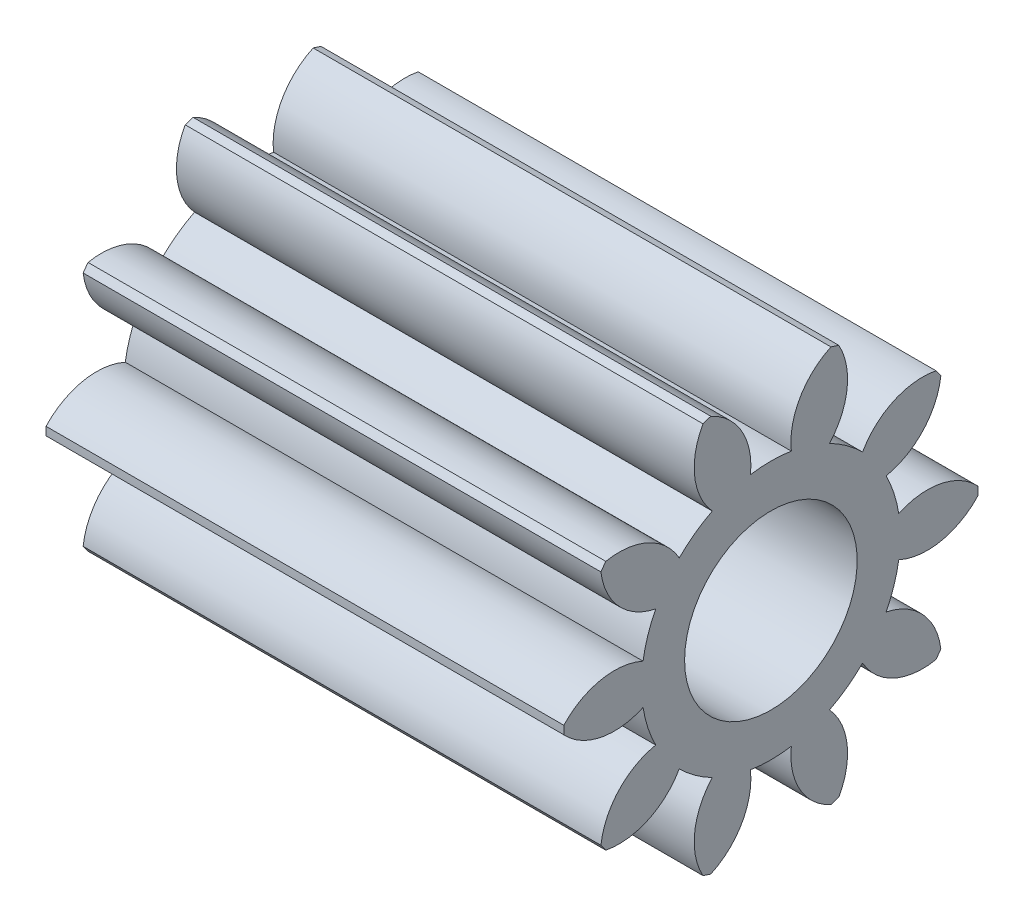
from build123d import *

# Parameters (mm, degrees)
BASPROSKE_W     = 12
BASPROSKE_H     = 4.8
TOOTHCUT_DEPTH  = 14.786950352
TEETHCUTS_COUNT = 10
TEETHCUTS_ANGLE = 324
BORSKE_R        = 2
BORE_DEPTH      = 50.0000508


with BuildPart() as part:
    # BasProSke → Base-Revolve (revolve)
    with BuildSketch(Plane(origin=(0, 0, 0), x_dir=(1, 0, 0), z_dir=(0, 1, 0)), mode=Mode.PRIVATE) as base_revolve_sk:
        with Locations((6, 2.4)):
            Rectangle(BASPROSKE_W, BASPROSKE_H)
    revolve(base_revolve_sk.sketch.rotate(Axis((-10, 0, 0), (1, 0, 0)), 180), axis=Axis((-10, 0, 0), (1, 0, 0)))

    # TooCutSke → ToothCut (cut, through all)
    with BuildSketch(Plane(origin=(0, 0, 0), x_dir=(0, 0, -1), z_dir=(1, 0, 0))):
        with BuildLine():
            ThreePointArc((0.473726058, 2.961348446), (0, 2.999), (-0.473726058, 2.961348446))
            ThreePointArc((-0.473726058, 2.961348446), (-0.678470427, 3.942691912), (-1.42693485, 4.6095924))
            ThreePointArc((-1.42693485, 4.6095924), (0, 4.8254), (1.42693485, 4.6095924))
            ThreePointArc((1.42693485, 4.6095924), (0.678470427, 3.942691912), (0.473726058, 2.961348446))
        make_face()
    toothcut = extrude(amount=TOOTHCUT_DEPTH, mode=Mode.SUBTRACT)

    # TeethCuts: ToothCut ×10 about axis
    teethcuts_axis = Axis((-10, 0, 0), (1, 0, 0))
    for i in range(1, TEETHCUTS_COUNT):
        add(toothcut.rotate(teethcuts_axis, i * TEETHCUTS_ANGLE / (TEETHCUTS_COUNT - 1)), mode=Mode.SUBTRACT)

    # BorSke → Bore (cut, symmetric)
    with BuildSketch(Plane(origin=(0, 0, 0), x_dir=(0, 0, -1), z_dir=(1, 0, 0))):
        with Locations(Location((0, 0, 0), (0, 0, 180))):
            Circle(BORSKE_R)
    extrude(amount=BORE_DEPTH, both=True, mode=Mode.SUBTRACT)


solid = part.part
